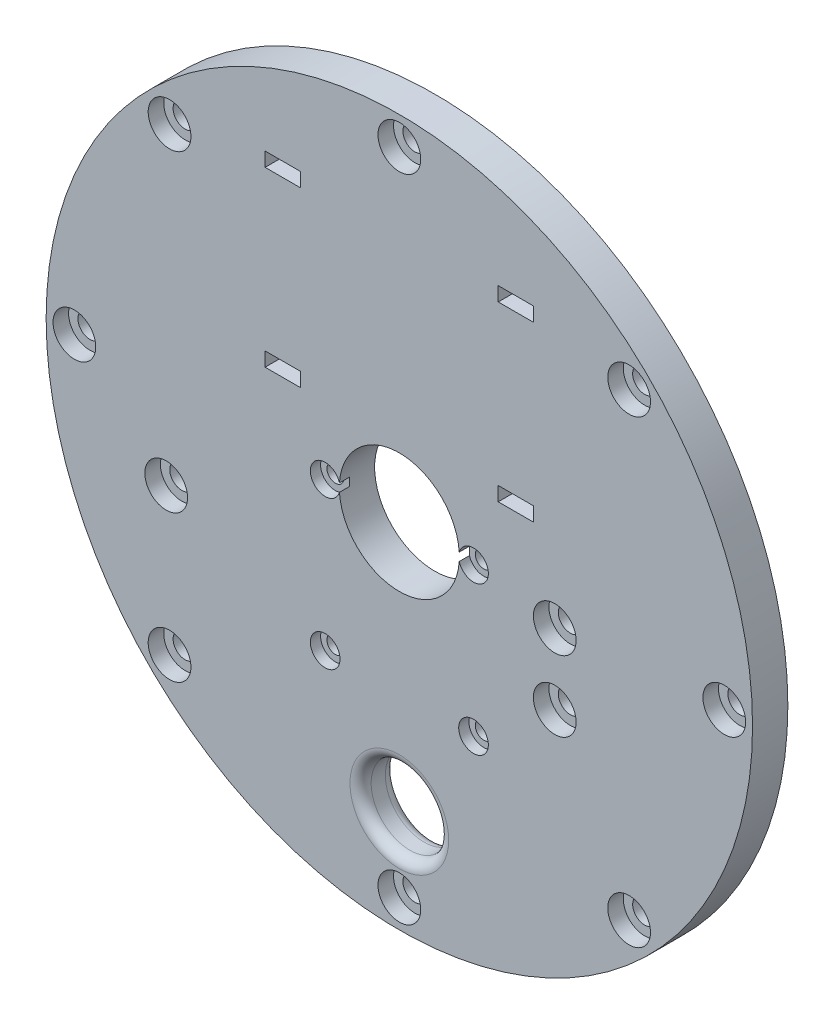
from build123d import *

# Parameters (mm, degrees)
SKETCH_1_R                   = 50
EXTRUDE_1_DEPTH              = 5
HOLE_WIZARD_M2_1_D           = 2.4
HOLE_WIZARD_M2_1_CBORE_D     = 4.2
HOLE_WIZARD_M2_1_CBORE_DEPTH = 1.45
HOLE_WIZARD_M3_2_D           = 3.4
HOLE_WIZARD_M3_2_CBORE_D     = 6.05
HOLE_WIZARD_M3_2_CBORE_DEPTH = 2.2
PATTERN_CIRCULAR_1_COUNT     = 8
SKETCH_6_R                   = 8.5
CUT_EXTRUDE_1_DEPTH          = 71.887234394
SKETCH_7_R                   = 5.4875
CUT_EXTRUDE_2_DEPTH          = 71.887234394
FILLET_1_R                   = 1.5
HOLE_WIZARD_M3_3_D           = 3.4
HOLE_WIZARD_M3_3_CBORE_D     = 6.05
HOLE_WIZARD_M3_3_CBORE_DEPTH = 2.2
SKETCH_12_W                  = 5
SKETCH_12_H                  = 2
CUT_EXTRUDE_4_DEPTH          = 71.887234394
SKETCH_14_W                  = 2
SKETCH_14_H                  = 5
EXTRUDE_2_DEPTH              = 3
FILLET_2_R                   = 1
FILLET_2_OF_MIRROR_2_R       = 1


with BuildPart() as part:
    # ｽｹｯﾁ1 → ﾎﾞｽ - 押し出し1 (new body)
    with BuildSketch(Plane.XY):
        Circle(SKETCH_1_R)
    extrude(amount=EXTRUDE_1_DEPTH)

    # M2 丸平ねじ用座ぐり穴1 (through all)
    with Locations(Plane.XY.offset(5)):
        with Locations((-10.5, 0), (-10.5, -21)):
            hole_wizard_m2_1 = CounterBoreHole(HOLE_WIZARD_M2_1_D / 2, HOLE_WIZARD_M2_1_CBORE_D / 2, HOLE_WIZARD_M2_1_CBORE_DEPTH)

    # ﾐﾗｰ1: M2 丸平ねじ用座ぐり穴1 across plane
    add(hole_wizard_m2_1.mirror(Plane(origin=(0, 0, 0), x_dir=(0, 0, 1), z_dir=(1, 0, 0))), mode=Mode.SUBTRACT)

    # M3 丸平ねじ用座ぐり穴2 (through all)
    with Locations(Plane.XY.offset(5)):
        with Locations((46, 0)):
            hole_wizard_m3_2 = CounterBoreHole(HOLE_WIZARD_M3_2_D / 2, HOLE_WIZARD_M3_2_CBORE_D / 2, HOLE_WIZARD_M3_2_CBORE_DEPTH)

    # 円形ﾊﾟﾀｰﾝ1: M3 丸平ねじ用座ぐり穴2 ×8 about axis
    pattern_circular_1_axis = Axis((0, 0, 0), (0, 0, 1))
    for i in range(1, PATTERN_CIRCULAR_1_COUNT):
        add(hole_wizard_m3_2.rotate(pattern_circular_1_axis, i * 360 / PATTERN_CIRCULAR_1_COUNT), mode=Mode.SUBTRACT)

    # ｽｹｯﾁ6 → ｶｯﾄ - 押し出し1 (cut, through all)
    with BuildSketch(Plane.XY.offset(5)):
        Circle(SKETCH_6_R)
    extrude(amount=-CUT_EXTRUDE_1_DEPTH, mode=Mode.SUBTRACT)

    # ｽｹｯﾁ7 → ｶｯﾄ - 押し出し2 (cut, through all)
    with BuildSketch(Plane.XY.offset(5)):
        with Locations((0, -35.4875)):
            Circle(SKETCH_7_R)
    extrude(amount=-CUT_EXTRUDE_2_DEPTH, mode=Mode.SUBTRACT)

    # ﾌｨﾚｯﾄ1
    fillet_1_edges = [part.edges().sort_by_distance(p)[0] for p in [
        (-5.4875, -35.4875, 0),
        (-5.4875, -35.4875, 5),
    ]]
    fillet(fillet_1_edges, radius=FILLET_1_R)

    # M3 丸平ねじ用座ぐり穴3 (through all)
    with Locations(Plane.XY.offset(5)):
        with Locations((22, -2), (22, -12), (-33, -12)):
            CounterBoreHole(HOLE_WIZARD_M3_3_D / 2, HOLE_WIZARD_M3_3_CBORE_D / 2, HOLE_WIZARD_M3_3_CBORE_DEPTH)

    # ｽｹｯﾁ12 → ｶｯﾄ - 押し出し4 (cut, through all)
    with BuildSketch(Plane(origin=(0, 0, 0), x_dir=(-1, 0, 0), z_dir=(0, 0, -1))):
        with Locations((16.5, 35)):
            Rectangle(SKETCH_12_W, SKETCH_12_H)
        with Locations((16.5, 10.5)):
            Rectangle(SKETCH_12_W, SKETCH_12_H)
    cut_extrude_4 = extrude(amount=-CUT_EXTRUDE_4_DEPTH, mode=Mode.SUBTRACT)

    # ｽｹｯﾁ14 → ﾎﾞｽ - 押し出し2 (add)
    with BuildSketch(Plane(origin=(0, 0, 0), x_dir=(-1, 0, 0), z_dir=(0, 0, -1))):
        with Locations((25, 29.5)):
            Rectangle(SKETCH_14_W, SKETCH_14_H)
        with Locations((25, 16)):
            Rectangle(SKETCH_14_W, SKETCH_14_H)
    extrude_2 = extrude(amount=EXTRUDE_2_DEPTH)

    # ﾌｨﾚｯﾄ2
    fillet_2_edges = [part.edges().sort_by_distance(p)[0] for p in [
        (-26, 29.5, 0),
        (-26, 16, 0),
    ]]
    fillet(fillet_2_edges, radius=FILLET_2_R)

    # ﾐﾗｰ2: ｶｯﾄ - 押し出し4, ﾎﾞｽ - 押し出し2 across plane
    add(cut_extrude_4.mirror(Plane(origin=(0, 0, 0), x_dir=(0, 0, 1), z_dir=(1, 0, 0))), mode=Mode.SUBTRACT)
    add(extrude_2.mirror(Plane(origin=(0, 0, 0), x_dir=(0, 0, 1), z_dir=(1, 0, 0))))

    # ﾌｨﾚｯﾄ2 of ﾐﾗｰ2
    fillet_2_of_mirror_2_edges = [part.edges().sort_by_distance(p)[0] for p in [
        (26, 29.5, 0),
        (26, 16, 0),
    ]]
    fillet(fillet_2_of_mirror_2_edges, radius=FILLET_2_OF_MIRROR_2_R)


solid = part.part
